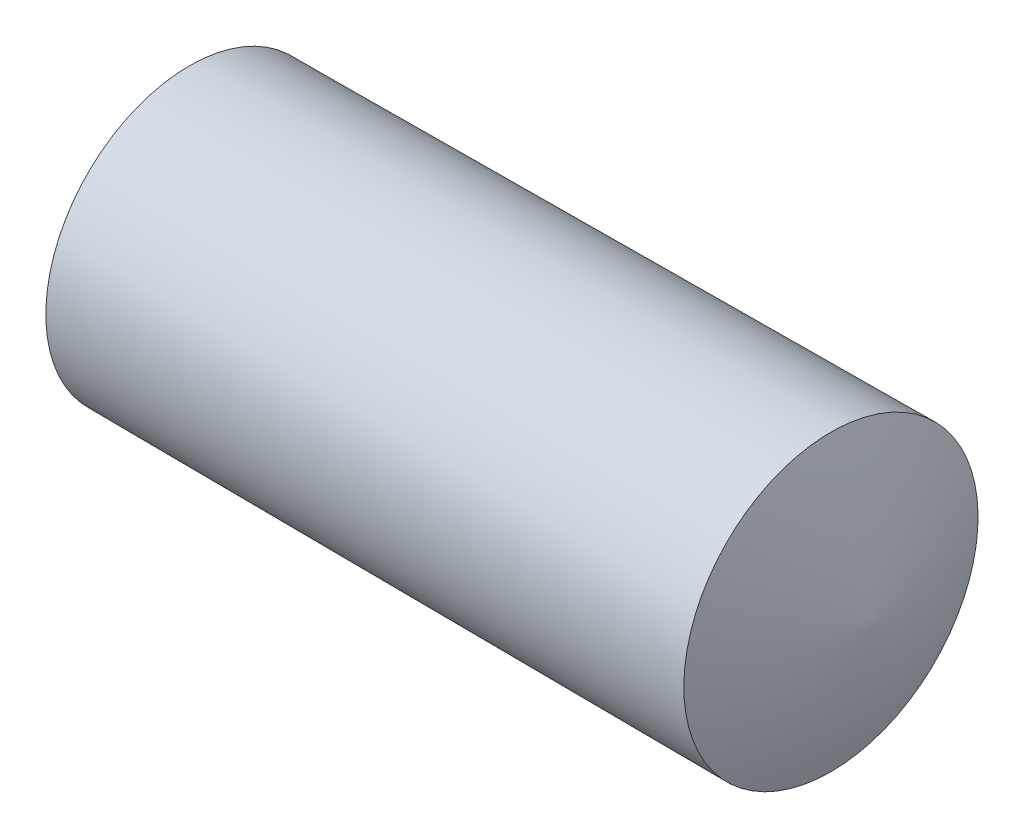
from build123d import *


with BuildPart() as part:
    # 草图1 → Revolve 599 (revolve)
    with BuildSketch(Plane.XY):
        with BuildLine():
            Line((-3.12, 0), (11.88, 0))
            ThreePointArc((11.88, 0), (11.57863497, -1.561969077), (11.08, -3.072575393))
            Line((11.08, -3.072575393), (-2.32, -3))
            ThreePointArc((-2.32, -3), (-2.817435485, -1.525982796), (-3.12, 0))
        make_face()
    revolve(axis=Axis((0, 0, 0), (1, 0, 0)))


solid = part.part
